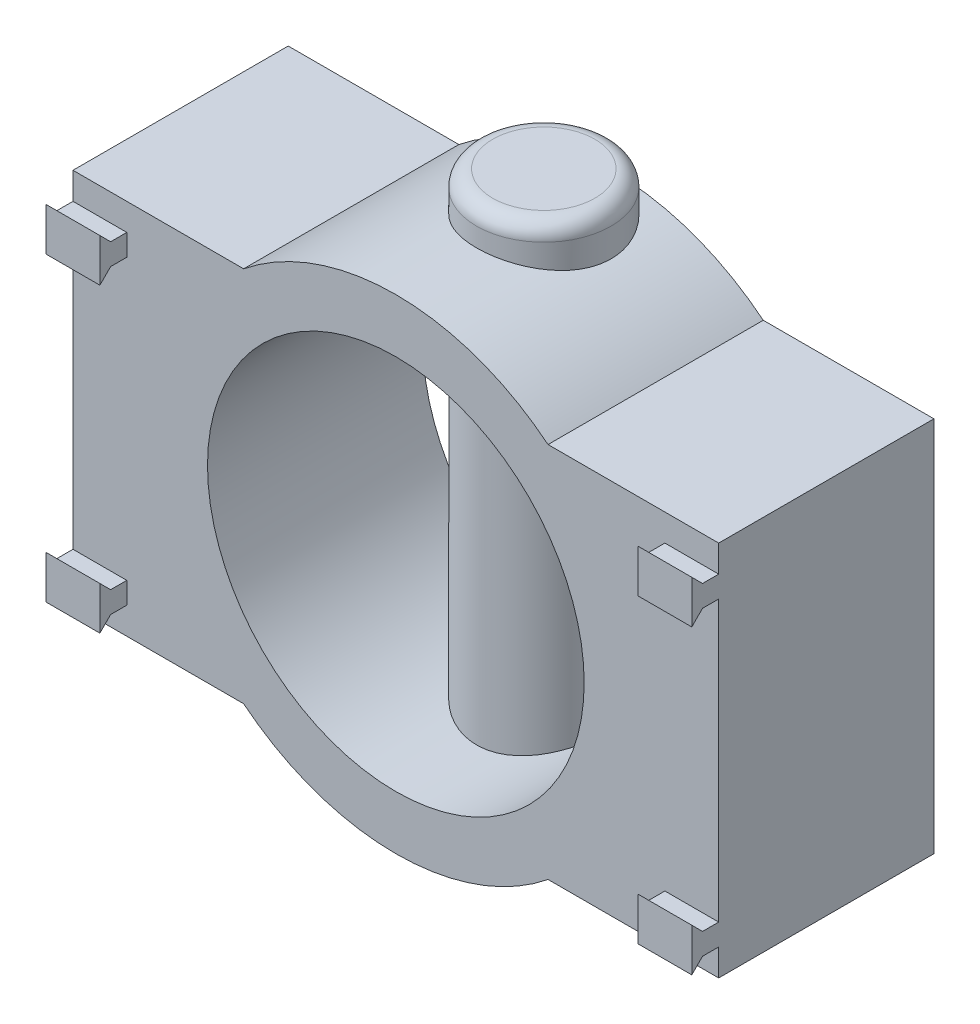
from build123d import *

# Parameters (mm, degrees)
ESQUISSE1_R                         = 12.5
BOSS_EXTRU_1_DEPTH                  = 100
CONG_1_R                            = 3
ESQUISSE2_R                         = 3
BOSS_EXTRU_2_DEPTH                  = 8
ESQUISSE3_W                         = 6
ESQUISSE3_H                         = 1.2
ENL_V_MAT_EXTRU_1_DEPTH             = 8
BOSS_EXTRU_3_DEPTH                  = 15
BOSS_EXTRU_3_DEPTH_BACK             = 25
ESQUISSE4_R                         = 45
ESQUISSE4_R_2                       = 35
BOSS_EXTRU_4_REACH                  = 149.585
BOSS_EXTRU_4_END_RADIUS             = 45
ESQUISSE5_W                         = 40
ESQUISSE5_H                         = 70
BOSS_EXTRU_5_DEPTH                  = 10
ESQUISSE8_R                         = 3
BOSS_EXTRU_6_DEPTH                  = 10
BOSS_EXTRU_6_DIRECTION_2_REACH      = 127
BOSS_EXTRU_6_DIRECTION_2_END_RADIUS = 12.5
ENL_V_MAT_EXTRU_2_REACH             = 130.938
ENL_V_MAT_EXTRU_2_END_RADIUS        = 12.5
ESQUISSE9_W                         = 6
ESQUISSE9_H                         = 1.2


with BuildPart() as part:
    # Esquisse1 → Boss.-Extru.1 (new body)
    with BuildSketch(Plane(origin=(0, 0, 0), x_dir=(1, 0, 0), z_dir=(0, 1, 0))):
        with Locations(Location((0, 0, 0), (0, 0, 270))):
            Circle(ESQUISSE1_R)
    extrude(amount=BOSS_EXTRU_1_DEPTH)

    # Congé1
    cong_1_edges = [part.edges().sort_by_distance(p)[0] for p in [
        (0, 100, -12.5),
    ]]
    fillet(cong_1_edges, radius=CONG_1_R)

    # Esquisse2 → Boss.-Extru.2 (add)
    with BuildSketch(Plane.XZ):
        with Locations(Location((0, 0, 0), (0, 0, 270))):
            Circle(ESQUISSE2_R)
    extrude(amount=BOSS_EXTRU_2_DEPTH)

    # Esquisse3 → Enlèv. mat.-Extru.1 (cut)
    with BuildSketch(Plane.XZ.offset(8)):
        with Locations((0, 2.4)):
            Rectangle(ESQUISSE3_W, ESQUISSE3_H)
    extrude(amount=-ENL_V_MAT_EXTRU_1_DEPTH, mode=Mode.SUBTRACT)



with BuildPart() as body_2:
    # Esquisse4 → Boss.-Extru.3 (new, two sides: drawn at the far end of the back side and taken through both)
    with BuildSketch(Plane.XY.offset(12.5).offset(-BOSS_EXTRU_3_DEPTH_BACK)):
        with Locations((0, 48.5)):
            Circle(ESQUISSE4_R)
        with Locations((0, 48.5)):
            Circle(ESQUISSE4_R_2, mode=Mode.SUBTRACT)
    extrude(amount=BOSS_EXTRU_3_DEPTH + BOSS_EXTRU_3_DEPTH_BACK)

    # Boss.-Extru.4: up to this cylinder (the profile starts outside it)
    boss_extru_4_end = Plane(origin=(0, 48.5, 7.5), z_dir=(0, 0, 1)) * Cylinder(BOSS_EXTRU_4_END_RADIUS, 390.17, mode=Mode.PRIVATE)
    # Esquisse5 → Boss.-Extru.4 (add, up to the surface)
    with BuildSketch(Plane(origin=(60, 0, 0), x_dir=(0, 0, -1), z_dir=(1, 0, 0)), mode=Mode.PRIVATE) as boss_extru_4_sk1:
        with Locations((-7.5, 48.5)):
            Rectangle(ESQUISSE5_W, ESQUISSE5_H)
    boss_extru_4_tool1 = extrude(boss_extru_4_sk1.sketch, amount=-BOSS_EXTRU_4_REACH, mode=Mode.PRIVATE) - boss_extru_4_end
    boss_extru_4 = boss_extru_4_tool1.solids().sort_by_distance((60, 48.5, 7.5))[0]
    add(boss_extru_4)

    # Symétrie1: Boss.-Extru.4 across plane
    add(boss_extru_4.mirror(Plane(origin=(0, 0, 0), x_dir=(0, 0, 1), z_dir=(1, 0, 0))))

    # Esquisse7 → Boss.-Extru.5 (add)
    with BuildSketch(Plane.ZY.offset(60)):
        Polygon((30.5, 22.5), (27.5, 22.5), (27.5, 18.5), (30.5, 18.5), (32.5, 16.5), (32.5, 24.5), align=None)
        Polygon((32.5, 80.5), (32.5, 72.5), (30.5, 74.5), (27.5, 74.5), (27.5, 78.5), (30.5, 78.5), align=None)
    boss_extru_5 = extrude(amount=-BOSS_EXTRU_5_DEPTH)

    # Symétrie2: Boss.-Extru.5 across plane
    add(boss_extru_5.mirror(Plane(origin=(0, 0, 0), x_dir=(0, 0, 1), z_dir=(1, 0, 0))))


with BuildPart() as part_1:
    add(part.part)

    add(body_2.part)  # Boss.-Extru.6 merges body 2
    # Esquisse8 → Boss.-Extru.6 (add)
    with BuildSketch(Plane(origin=(0, 0, -12.5), x_dir=(-1, 0, 0), z_dir=(0, 0, -1))):
        with Locations(Location((0, 48.5, 0), (0, 0, 90))):
            Circle(ESQUISSE8_R)
    extrude(amount=BOSS_EXTRU_6_DEPTH)

    # Boss.-Extru.6 direction 2: up to this cylinder (the profile starts outside it)
    boss_extru_6_direction_2_end = Plane(origin=(0, 48.5, 0), z_dir=(0, -1, 0)) * Cylinder(BOSS_EXTRU_6_DIRECTION_2_END_RADIUS, 280, mode=Mode.PRIVATE)
    # Esquisse8 → Boss.-Extru.6 direction 2 (add, up to the surface)
    with BuildSketch(Plane(origin=(0, 0, -12.5), x_dir=(-1, 0, 0), z_dir=(0, 0, -1)), mode=Mode.PRIVATE) as boss_extru_6_direction_2_sk1:
        with Locations(Location((0, 48.5, 0), (0, 0, 90))):
            Circle(ESQUISSE8_R)
    boss_extru_6_direction_2_tool1 = extrude(boss_extru_6_direction_2_sk1.sketch, amount=-BOSS_EXTRU_6_DIRECTION_2_REACH, mode=Mode.PRIVATE) - boss_extru_6_direction_2_end
    add(boss_extru_6_direction_2_tool1.solids().sort_by_distance((0, 48.5, -12.5))[0])
    add(boss_extru_6_direction_2_tool1.solids().sort_by_distance((0, 48.5, -12.5))[1])

    # Enlèv. mat.-Extru.2: up to this cylinder (the profile starts outside it)
    enl_v_mat_extru_2_end = Plane(origin=(0, 50.9, 0), z_dir=(0, -1, 0)) * Cylinder(ENL_V_MAT_EXTRU_2_END_RADIUS, 287.876, mode=Mode.PRIVATE)
    # Esquisse9 → Enlèv. mat.-Extru.2 (cut, up to the surface)
    with BuildSketch(Plane(origin=(0, 0, -22.5), x_dir=(-1, 0, 0), z_dir=(0, 0, -1)), mode=Mode.PRIVATE) as enl_v_mat_extru_2_sk1:
        with Locations((0, 50.9)):
            Rectangle(ESQUISSE9_W, ESQUISSE9_H)
    enl_v_mat_extru_2_tool1 = extrude(enl_v_mat_extru_2_sk1.sketch, amount=-ENL_V_MAT_EXTRU_2_REACH, mode=Mode.PRIVATE) - enl_v_mat_extru_2_end
    add(enl_v_mat_extru_2_tool1.solids().sort_by_distance((0, 50.9, -22.5))[0], mode=Mode.SUBTRACT)


solid = part_1.part
